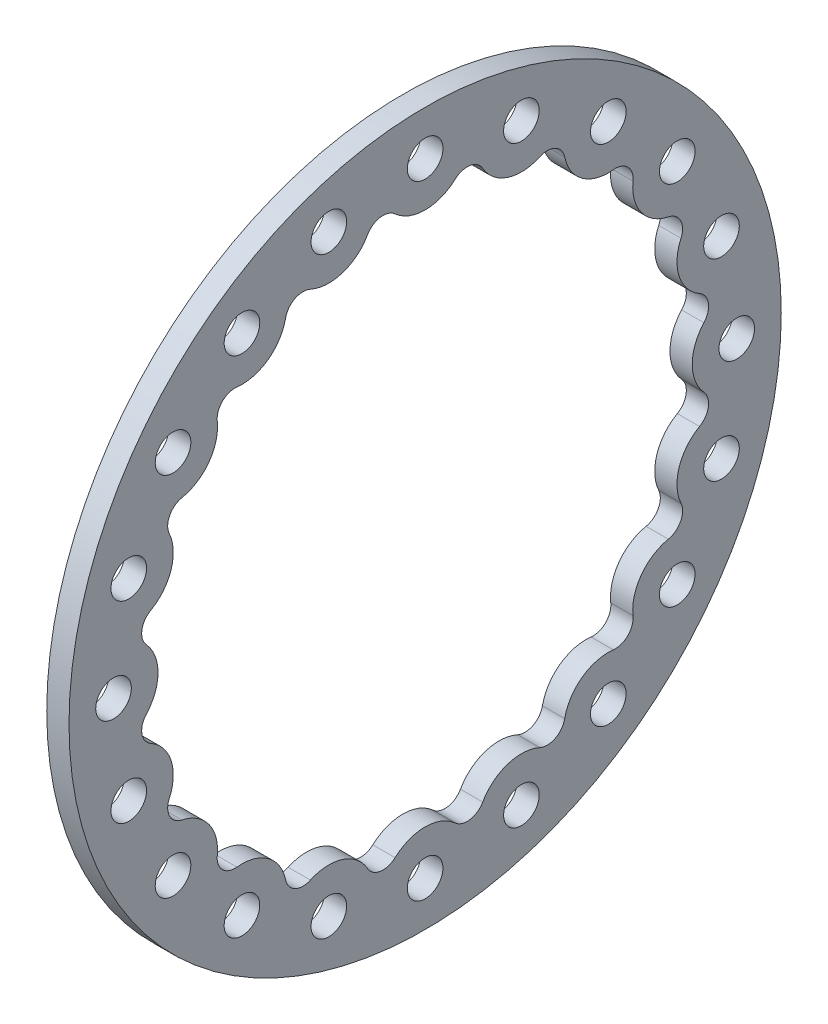
from build123d import *

# Parameters (mm, degrees)
SKETCH1_R           = 80
SKETCH1_R_2         = 60
BOSS_EXTRUDE1_DEPTH = 2.5
SKETCH2_R           = 4
CUT_EXTRUDE1_DEPTH  = 114.247516529
CIRPATTERN1_COUNT   = 20


with BuildPart() as part:
    # Sketch1 → Boss-Extrude1 (new, symmetric)
    with BuildSketch(Plane(origin=(0, 0, 0), x_dir=(0, 0, -1), z_dir=(1, 0, 0))):
        Circle(SKETCH1_R)
        Circle(SKETCH1_R_2, mode=Mode.SUBTRACT)
    extrude(amount=BOSS_EXTRUDE1_DEPTH, both=True)

    # Sketch2 → Cut-Extrude1 (cut, through all)
    with BuildSketch(Plane(origin=(2.5, 0, 0), x_dir=(0, 0, -1), z_dir=(1, 0, 0))):
        with Locations((0, 70)):
            Circle(SKETCH2_R)
        with BuildLine():
            Line((-7.996862967, 55.945192077), (7.996862967, 55.945192077))
            ThreePointArc((7.996862967, 55.945192077), (13.383151066, 60.405313548), (6.750740904, 62.622500611))
            ThreePointArc((6.750740904, 62.622500611), (0, 60), (-6.750740904, 62.622500611))
            ThreePointArc((-6.750740904, 62.622500611), (-13.383151066, 60.405313548), (-7.996862967, 55.945192077))
        make_face()
    cut_extrude1 = extrude(amount=-CUT_EXTRUDE1_DEPTH, mode=Mode.SUBTRACT)

    # CirPattern1: Cut-Extrude1 ×20 about axis
    cirpattern1_axis = Axis((2.5, 0, 0), (-1, 0, 0))
    for i in range(1, CIRPATTERN1_COUNT):
        add(cut_extrude1.rotate(cirpattern1_axis, i * 360 / CIRPATTERN1_COUNT), mode=Mode.SUBTRACT)


solid = part.part
